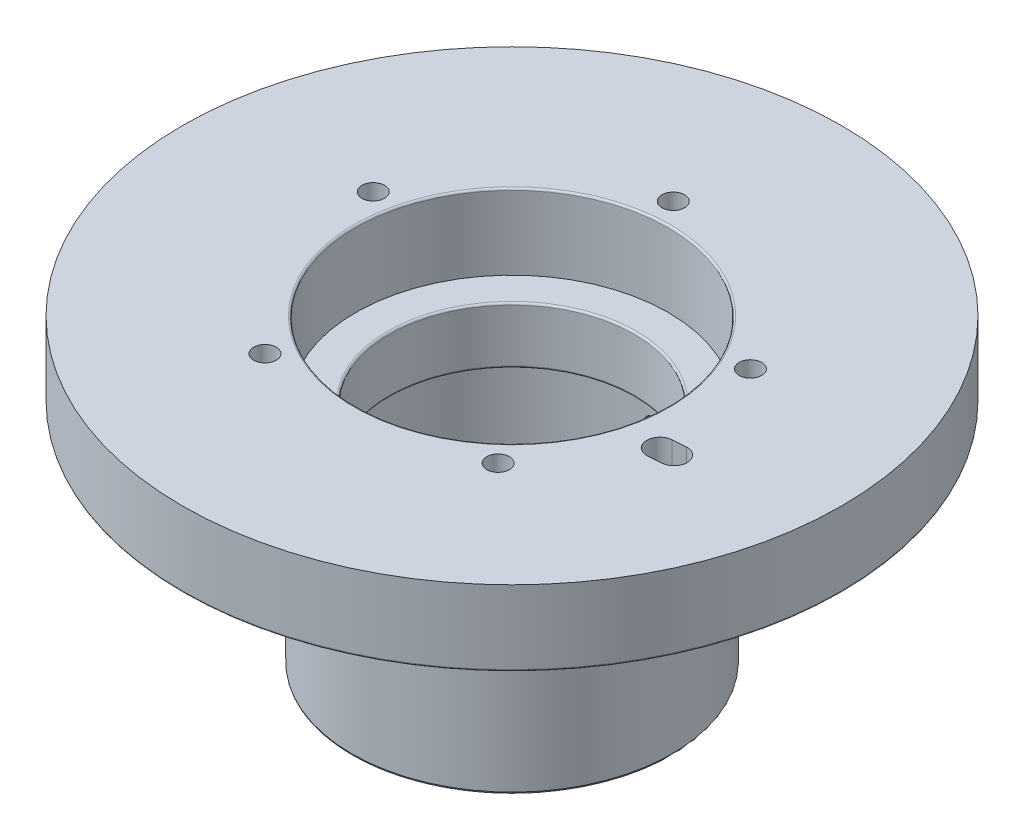
from build123d import *

# Parameters (mm, degrees)
CUT_EXTRUDE6_DEPTH      = 148.351620397
CUT_EXTRUDE6_DEPTH_BACK = 148.351620397
SKETCH6_R               = 2.5
SKETCH8_R               = 3
CUT_EXTRUDE8_DEPTH      = 15
CUT_EXTRUDE9_DEPTH      = 148.351620397


with BuildPart() as part:
    # Sketch1 → Revolve1 (revolve)
    with BuildSketch(Plane.XY):
        with BuildLine():
            Line((-87.5, -19.5), (-87.5, 0))
            Line((-87.5, 0), (-42, 0))
            ThreePointArc((-42, 0), (-41.646446609, -0.146446609), (-41.5, -0.5))
            Line((-41.5, -0.5), (-41.5, -20))
            Line((-41.5, -20), (-33, -20))
            ThreePointArc((-33, -20), (-32.646446609, -20.146446609), (-32.5, -20.5))
            Line((-32.5, -20.5), (-32.5, -34.5))
            ThreePointArc((-32.5, -34.5), (-32.646446609, -34.853553391), (-33, -35))
            Line((-33, -35), (-37, -35))
            ThreePointArc((-37, -35), (-37.353553391, -35.146446609), (-37.5, -35.5))
            Line((-37.5, -35.5), (-37.5, -79.5))
            ThreePointArc((-37.5, -79.5), (-37.646446609, -79.853553391), (-38, -80))
            Line((-38, -80), (-42, -80))
            ThreePointArc((-42, -80), (-42.353553391, -79.853553391), (-42.5, -79.5))
            Line((-42.5, -79.5), (-42.5, -25.5))
            ThreePointArc((-42.5, -25.5), (-42.646446609, -25.146446609), (-43, -25))
            Line((-43, -25), (-47, -25))
            ThreePointArc((-47, -25), (-47.353553391, -24.853553391), (-47.5, -24.5))
            Line((-47.5, -24.5), (-47.5, -20.5))
            ThreePointArc((-47.5, -20.5), (-47.646446609, -20.146446609), (-48, -20))
            Line((-48, -20), (-87, -20))
            ThreePointArc((-87, -20), (-87.353553391, -19.853553391), (-87.5, -19.5))
        make_face()
    revolve(axis=Axis((0, -100.5, 0), (0, 1, 0)))

    # Sketch6 → Cut-Extrude6 (cut, two sides: drawn at the far end of the back side and taken through both)
    with BuildSketch(Plane.XY.offset(-CUT_EXTRUDE6_DEPTH_BACK)):
        with Locations((0, -44.5)):
            Circle(SKETCH6_R)
    extrude(amount=CUT_EXTRUDE6_DEPTH + CUT_EXTRUDE6_DEPTH_BACK, mode=Mode.SUBTRACT)

    # Sketch8 → Cut-Extrude8 (cut)
    with BuildSketch(Plane(origin=(0, 0, 0), x_dir=(1, 0, 0), z_dir=(0, 1, 0))):
        with Locations((43.889838941, 19.434043267)):
            Circle(SKETCH8_R)
        with Locations((-4.920167374, 47.747166963)):
            Circle(SKETCH8_R)
        with Locations((-46.930669609, 10.075328782)):
            Circle(SKETCH8_R)
        with Locations((-24.084581559, -41.520271328)):
            Circle(SKETCH8_R)
        with Locations((32.045579601, -35.736267685)):
            Circle(SKETCH8_R)
    extrude(amount=-CUT_EXTRUDE8_DEPTH, mode=Mode.SUBTRACT)

    # Sketch9 → Cut-Extrude9 (cut, through all)
    with BuildSketch(Plane(origin=(0, 0, 0), x_dir=(1, 0, 0), z_dir=(0, 1, 0))):
        with BuildLine():
            Line((53.768061866, -13.987725184), (50.276679454, -14.233181596))
            ThreePointArc((50.276679454, -14.233181596), (46.539840629, -10.987255596), (49.785766629, -7.250416771))
            Line((49.785766629, -7.250416771), (53.277149042, -7.004960359))
            ThreePointArc((53.277149042, -7.004960359), (57.013987866, -10.250886359), (53.768061866, -13.987725184))
        make_face()
    extrude(amount=-CUT_EXTRUDE9_DEPTH, mode=Mode.SUBTRACT)


solid = part.part
